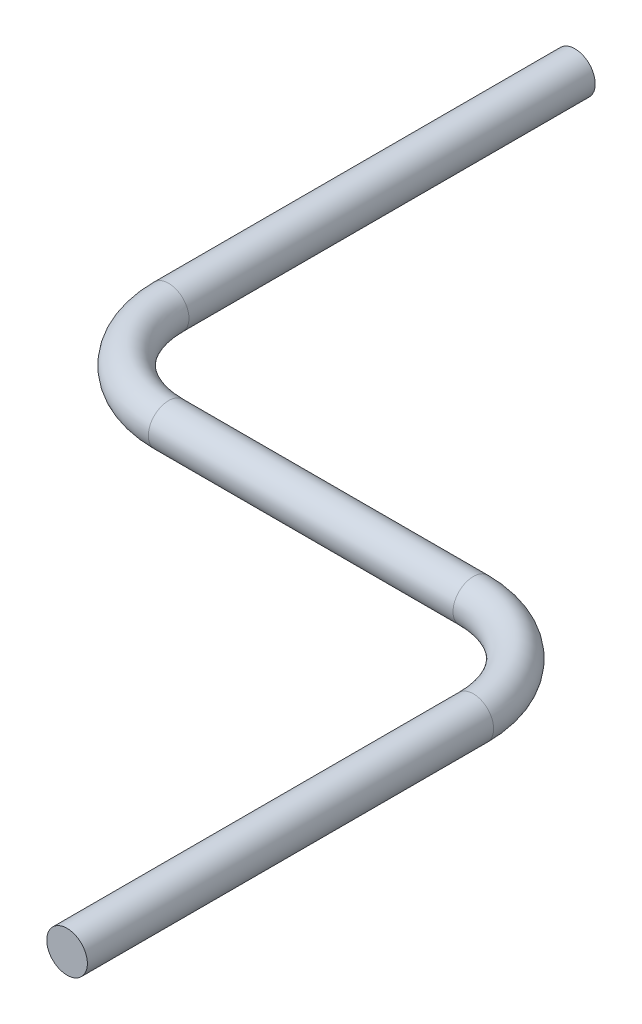
from build123d import *

# Parameters (mm, degrees)
SKETCH_1_R = 2


with BuildPart() as part:
    # ｽｲｰﾌﾟ1: sweep along a path in ｽｹｯﾁ2
    with BuildLine(Plane(origin=(0, 0, 0), x_dir=(1, 0, 0), z_dir=(0, 1, 0))) as sweep_1_path:
        Line((0, 0), (0, -40))
        ThreePointArc((0, -40), (2.928932188, -47.071067812), (10, -50))
        Line((10, -50), (40, -50))
        ThreePointArc((40, -50), (47.071067812, -52.928932188), (50, -60))
        Line((50, -60), (50, -100))
    # ｽｹｯﾁ1 → ｽｲｰﾌﾟ1 (sweep)
    with BuildSketch(Plane.XY):
        Circle(SKETCH_1_R)
    sweep(path=sweep_1_path.line)


solid = part.part
